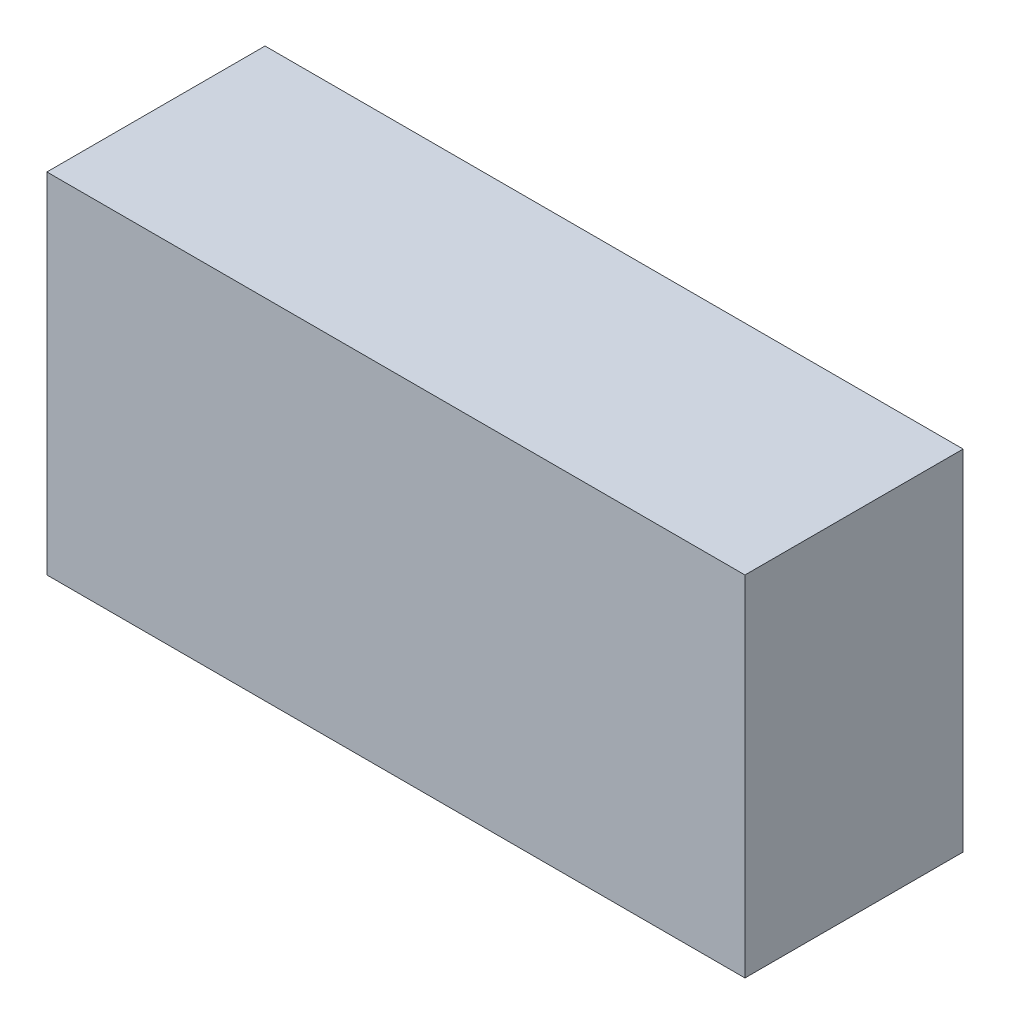
from build123d import *

# Parameters (mm, degrees)
SKETCH1_W           = 1.6
SKETCH1_H           = 0.8
BOSS_EXTRUDE1_DEPTH = 0.5


with BuildPart() as part:
    # Sketch1 → Boss-Extrude1 (new body)
    with BuildSketch(Plane.XY):
        Rectangle(SKETCH1_W, SKETCH1_H)
    extrude(amount=BOSS_EXTRUDE1_DEPTH)


solid = part.part
